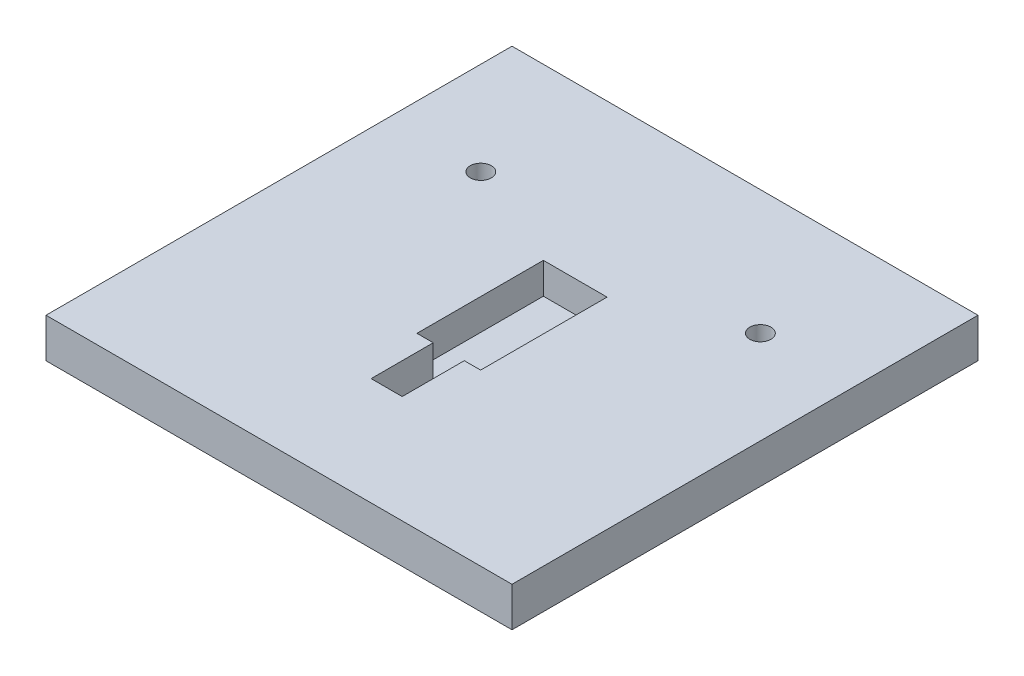
from build123d import *

# Parameters (mm, degrees)
ESBO_O1_W                = 150
ESBO_O1_H                = 150
RESSALTO_EXTRUS_O2_DEPTH = 12.7
CORTE_EXTRUS_O1_DEPTH    = 10
ESBO_O4_W                = 10
ESBO_O4_H                = 10
CORTE_EXTRUS_O2_DEPTH    = 107.823639706
ESBO_O5_R                = 3
CORTE_EXTRUS_O3_DEPTH    = 12.7
FURO_ROSCADO_DE_M83_D    = 6.8


with BuildPart() as part:
    # Esboço1 → Ressalto-extrusão2 (new body)
    with BuildSketch(Plane(origin=(0, 0, 0), x_dir=(1, 0, 0), z_dir=(0, 1, 0))):
        Rectangle(ESBO_O1_W, ESBO_O1_H)
    extrude(amount=RESSALTO_EXTRUS_O2_DEPTH)

    # Esboço2 → Corte-extrusão1 (cut)
    with BuildSketch(Plane(origin=(0, 12.7, 0), x_dir=(1, 0, 0), z_dir=(0, 1, 0))):
        Polygon((10.25, -20.35), (10.25, 20.35), (-10.25, 20.35), (-10.25, -20.35), (-5, -20.35), (-5, -30.35), (5, -30.35), (5, -20.35), align=None)
    extrude(amount=-CORTE_EXTRUS_O1_DEPTH, mode=Mode.SUBTRACT)

    # Esboço4 → Corte-extrusão2 (cut, through all)
    with BuildSketch(Plane(origin=(0, 12.7, 0), x_dir=(1, 0, 0), z_dir=(0, 1, 0))):
        with Locations((0, -35.35)):
            Rectangle(ESBO_O4_W, ESBO_O4_H)
    extrude(amount=-CORTE_EXTRUS_O2_DEPTH, mode=Mode.SUBTRACT)

    # Esboço5 → Corte-extrusão3 (cut)
    with BuildSketch(Plane(origin=(0, 0, 0), x_dir=(-1, 0, 0), z_dir=(0, -1, 0))):
        with Locations(Location((-45, 34.96, 0), (0, 0, 90))):
            Circle(ESBO_O5_R)
        with Locations(Location((45, 34.96, 0), (0, 0, 90))):
            Circle(ESBO_O5_R)
    extrude(amount=-CORTE_EXTRUS_O3_DEPTH, mode=Mode.SUBTRACT)

    # Furo roscado de M83 (through all)
    with Locations(Plane(origin=(0, 12.7, 0), x_dir=(1, 0, 0), z_dir=(0, 1, 0))):
        with Locations((45, 34.96), (-45, 34.96)):
            Hole(FURO_ROSCADO_DE_M83_D / 2)


solid = part.part
